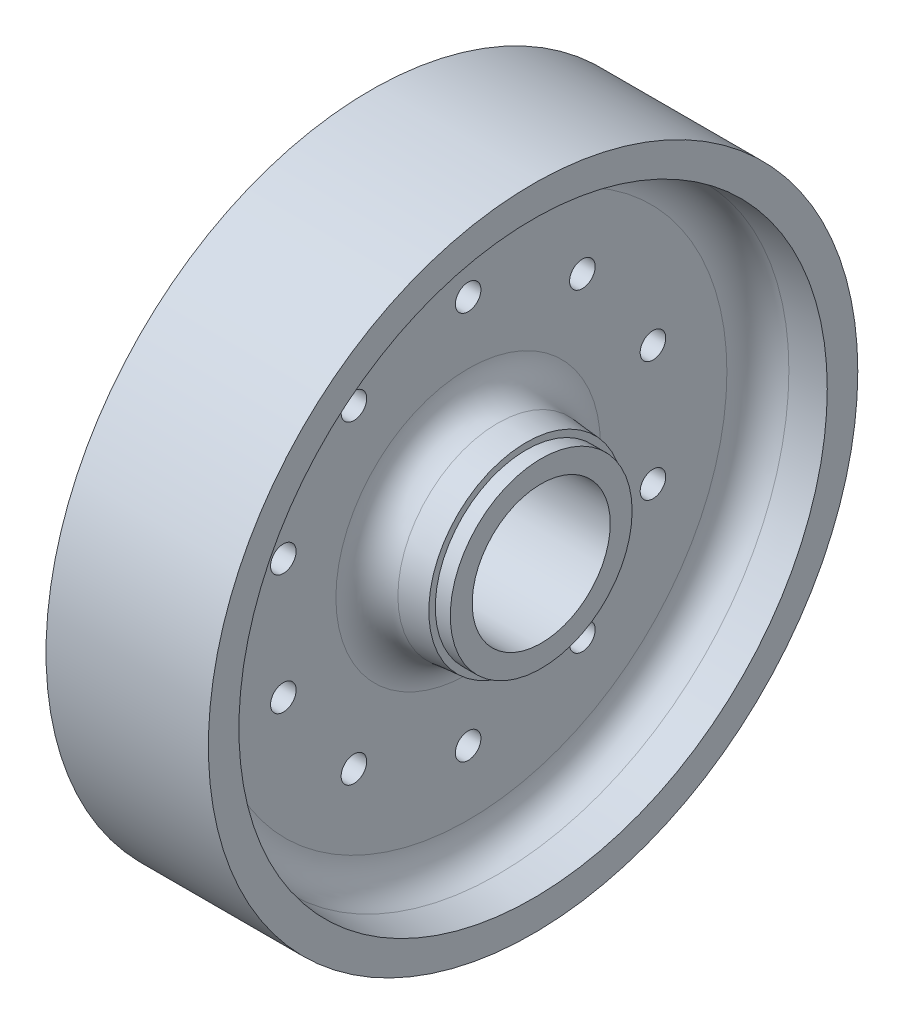
from build123d import *

# Parameters (mm, degrees)
CORTE_EXTRUS_O3_DEPTH      = 92.484637542
CORTE_EXTRUS_O3_DEPTH_BACK = 92.484637542
ESBO_O2_R                  = 2.5


with BuildPart() as part:
    # Esboço1 → Revolução1 (revolve)
    with BuildSketch(Plane.XY, mode=Mode.PRIVATE) as revolu_o1_sk:
        with BuildLine():
            Line((-14.5288, 17.78), (-17.4625, 17.78))
            Line((-17.4625, 17.78), (-17.4625, 13.5001))
            Line((-17.4625, 13.5001), (17.4625, 13.5001))
            Line((17.4625, 13.5001), (17.4625, 17.78))
            Line((17.4625, 17.78), (14.5288, 17.78))
            Line((14.5288, 17.78), (14.5288, 19.05))
            Line((14.5288, 19.05), (8.971561034, 19.53619541))
            ThreePointArc((8.971561034, 19.53619541), (4.843288911, 21.572033925), (3.175, 25.862031743))
            Line((3.175, 25.862031743), (3.175, 50.601191018))
            ThreePointArc((3.175, 50.601191018), (4.843288911, 54.891188837), (8.971561034, 56.927027351))
            Line((8.971561034, 56.927027351), (15.875, 57.531))
            Line((15.875, 57.531), (15.875, 63.5))
            Line((15.875, 63.5), (-15.875, 63.5))
            Line((-15.875, 63.5), (-15.875, 57.531))
            Line((-15.875, 57.531), (-8.971561034, 56.927027351))
            ThreePointArc((-8.971561034, 56.927027351), (-4.843288911, 54.891188837), (-3.175, 50.601191018))
            Line((-3.175, 50.601191018), (-3.175, 25.862031743))
            ThreePointArc((-3.175, 25.862031743), (-4.843288911, 21.572033925), (-8.971561034, 19.53619541))
            Line((-8.971561034, 19.53619541), (-14.5288, 19.05))
            Line((-14.5288, 19.05), (-14.5288, 17.78))
        make_face()
    revolve(revolu_o1_sk.sketch.rotate(Axis((-17.4625, 0, 0), (1, 0, 0)), 270), axis=Axis((-17.4625, 0, 0), (1, 0, 0)))

    # Esboço2 → Corte-extrusão3 (cut, two sides: drawn at the far end of the back side and taken through both)
    with BuildSketch(Plane(origin=(0, 0, 0), x_dir=(0, 0, -1), z_dir=(1, 0, 0)).offset(-CORTE_EXTRUS_O3_DEPTH_BACK)):
        with Locations((0, 38)):
            Circle(ESBO_O2_R)
        with Locations((22.335839587, 30.742645786)):
            Circle(ESBO_O2_R)
        with Locations((36.140147619, 11.742645786)):
            Circle(ESBO_O2_R)
        with Locations((36.140147619, -11.742645786)):
            Circle(ESBO_O2_R)
        with Locations((22.335839587, -30.742645786)):
            Circle(ESBO_O2_R)
        with Locations((0, -38)):
            Circle(ESBO_O2_R)
        with Locations((-22.335839587, -30.742645786)):
            Circle(ESBO_O2_R)
        with Locations((-36.140147619, -11.742645786)):
            Circle(ESBO_O2_R)
        with Locations((-36.140147619, 11.742645786)):
            Circle(ESBO_O2_R)
        with Locations((-22.335839587, 30.742645786)):
            Circle(ESBO_O2_R)
    extrude(amount=CORTE_EXTRUS_O3_DEPTH + CORTE_EXTRUS_O3_DEPTH_BACK, mode=Mode.SUBTRACT)


solid = part.part
